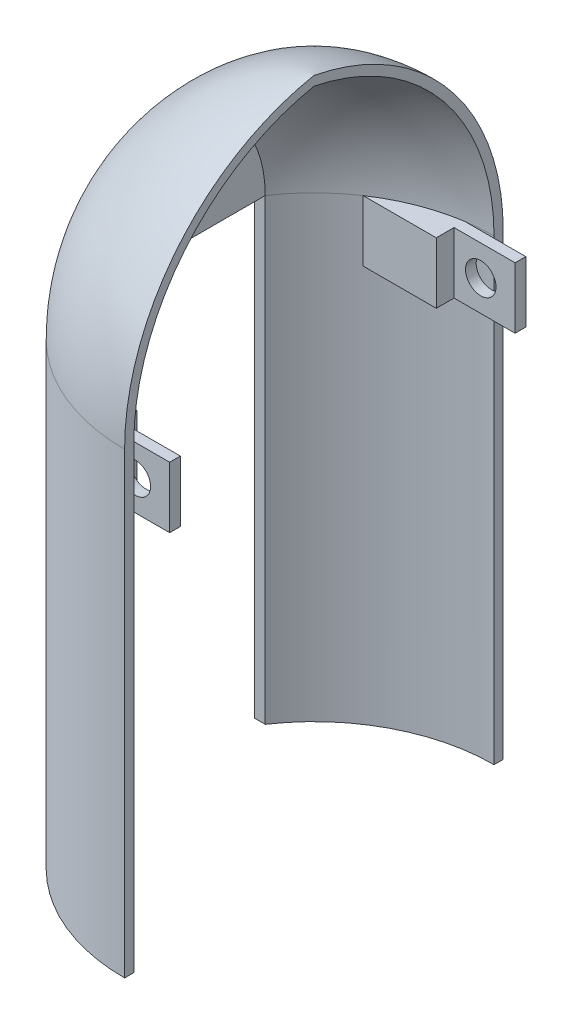
from build123d import *

# Parameters (mm, degrees)
SKETCH2_OUTSIDE_W        = 164.146
SKETCH2_OUTSIDE_H        = 164.146
SKETCH2_OUTSIDE_W_2      = 105
SKETCH2_OUTSIDE_H_2      = 145.767420334
CUT_EXTRUDE2_DEPTH       = 116.381974501
BOSS_EXTRUDE2_REACH      = 112.568
SKETCH3_W                = 3.579145551
SKETCH3_H                = 65.962110336
BOSS_EXTRUDE4_DEPTH      = 150
CUT_EXTRUDE3_DEPTH       = 171.58815789
CUT_EXTRUDE3_DEPTH_BACK  = 171.58815789
SKETCH5_W                = 89.03939756
SKETCH5_H                = 235.639617785
SKETCH6_R                = 1.8
CUT_EXTRUDE4_DEPTH       = 171.587954009
BOSS_EXTRUDE5_REACH      = 170.057
BOSS_EXTRUDE5_END_RADIUS = 59
SKETCH8_W                = 10
SKETCH8_H                = 20
SKETCH9_W                = 3.5
SKETCH9_H                = 20
BOSS_EXTRUDE6_DEPTH      = 20
CUT_EXTRUDE5_REACH       = 201.333
SKETCH10_R               = 5


with BuildPart() as part:
    # Sketch1 → Revolve1 (revolve)
    with BuildSketch(Plane.XY):
        with BuildLine():
            Line((62, 0), (59, 0))
            ThreePointArc((59, 0), (42.363721251, 46.52102369), (0, 71.943189953))
            Line((0, 71.943189953), (0, 75))
            ThreePointArc((0, 75), (44.493217858, 48.65439343), (62, 0))
        make_face()
    revolve(axis=Axis((0, 75, 0), (0, -1, 0)))

    # Sketch2 outside → Cut-Extrude2 (cut, through all)
    with BuildSketch(Plane(origin=(0, 0, 0), x_dir=(-1, 0, 0), z_dir=(0, -1, 0))):
        Rectangle(SKETCH2_OUTSIDE_W, SKETCH2_OUTSIDE_H)
        Rectangle(SKETCH2_OUTSIDE_W_2, SKETCH2_OUTSIDE_H_2, mode=Mode.SUBTRACT)
    extrude(amount=-CUT_EXTRUDE2_DEPTH, mode=Mode.SUBTRACT)

    # Sketch3 → Boss-Extrude2 (add, up to next)
    with BuildSketch(Plane.XZ, mode=Mode.PRIVATE) as boss_extrude2_sk1:
        with Locations((-50.710427225, 0)):
            Rectangle(SKETCH3_W, SKETCH3_H)
    boss_extrude2_tool1 = extrude(boss_extrude2_sk1.sketch, amount=-BOSS_EXTRUDE2_REACH, mode=Mode.PRIVATE) - part.part
    # Sketch3 → Boss-Extrude2 (add, up to next)
    with BuildSketch(Plane.XZ, mode=Mode.PRIVATE) as boss_extrude2_sk2:
        with Locations((50.710427225, 0)):
            Rectangle(SKETCH3_W, SKETCH3_H)
    boss_extrude2_tool2 = extrude(boss_extrude2_sk2.sketch, amount=-BOSS_EXTRUDE2_REACH, mode=Mode.PRIVATE) - part.part
    add(boss_extrude2_tool1.solids().sort_by_distance((-50.710427, 0, 0))[0])
    add(boss_extrude2_tool2.solids().sort_by_distance((50.710427, 0, 0))[0])

    # Sketch4 → Boss-Extrude4 (add)
    with BuildSketch(Plane(origin=(0, 0, 0), x_dir=(-1, 0, 0), z_dir=(0, -1, 0))):
        with BuildLine():
            Line((52.500662853, -32.98), (48.921565797, -32.98))
            ThreePointArc((48.921565797, -32.98), (0, -59), (-48.921565797, -32.98))
            Line((-48.921565797, -32.98), (-52.500662853, -32.98))
            ThreePointArc((-52.500662853, -32.98), (0, -62), (52.500662853, -32.98))
        make_face()
        with BuildLine():
            Line((-48.921565797, 32.98), (-52.500662853, 32.98))
            ThreePointArc((-52.500662853, 32.98), (0, 62), (52.500662853, 32.98))
            Line((52.500662853, 32.98), (48.921565797, 32.98))
            ThreePointArc((48.921565797, 32.98), (0, 59), (-48.921565797, 32.98))
        make_face()
    extrude(amount=BOSS_EXTRUDE4_DEPTH)

    # Sketch5 → Cut-Extrude3 (cut, two sides: drawn at the far end of the back side and taken through both)
    with BuildSketch(Plane.XY.offset(-CUT_EXTRUDE3_DEPTH_BACK)):
        with Locations((44.51969878, -36.450714171)):
            Rectangle(SKETCH5_W, SKETCH5_H)
    extrude(amount=CUT_EXTRUDE3_DEPTH + CUT_EXTRUDE3_DEPTH_BACK, mode=Mode.SUBTRACT)

    # Sketch6 → Cut-Extrude4 (cut, through all)
    with BuildSketch(Plane.ZY.offset(52.5)):
        with Locations((-5, 10)):
            Circle(SKETCH6_R)
        with Locations((5, 10)):
            Circle(SKETCH6_R)
    extrude(amount=-CUT_EXTRUDE4_DEPTH, mode=Mode.SUBTRACT)

    # Boss-Extrude5: up to this cylinder (the profile starts inside it)
    boss_extrude5_end = Plane(origin=(0, -10, 0), z_dir=(0, 1, 0)) * Cylinder(BOSS_EXTRUDE5_END_RADIUS, 459.114, mode=Mode.PRIVATE)
    # Sketch8 → Boss-Extrude5 (add, up to the surface)
    with BuildSketch(Plane(origin=(-8.920854449, 0, 0), x_dir=(0, 0, -1), z_dir=(1, 0, 0)), mode=Mode.PRIVATE) as boss_extrude5_sk1:
        with Locations((54, -10)):
            Rectangle(SKETCH8_W, SKETCH8_H)
    boss_extrude5_tool1 = extrude(boss_extrude5_sk1.sketch, amount=-BOSS_EXTRUDE5_REACH, mode=Mode.PRIVATE) & boss_extrude5_end
    add(boss_extrude5_tool1.solids().sort_by_distance((-8.920854, -10, -54))[0])
    # Sketch8 → Boss-Extrude5 (add, up to the surface)
    with BuildSketch(Plane(origin=(-8.920854449, 0, 0), x_dir=(0, 0, -1), z_dir=(1, 0, 0)), mode=Mode.PRIVATE) as boss_extrude5_sk2:
        with Locations((-54, -10)):
            Rectangle(SKETCH8_W, SKETCH8_H)
    boss_extrude5_tool2 = extrude(boss_extrude5_sk2.sketch, amount=-BOSS_EXTRUDE5_REACH, mode=Mode.PRIVATE) & boss_extrude5_end
    add(boss_extrude5_tool2.solids().sort_by_distance((-8.920854, -10, 54))[0])

    # Sketch9 → Boss-Extrude6 (add)
    with BuildSketch(Plane(origin=(-8.920854449, 0, 0), x_dir=(0, 0, -1), z_dir=(1, 0, 0))):
        with Locations((56.571679982, -10)):
            Rectangle(SKETCH9_W, SKETCH9_H)
        with Locations((-56.571679982, -10)):
            Rectangle(SKETCH9_W, SKETCH9_H)
    extrude(amount=BOSS_EXTRUDE6_DEPTH)

    # Cut-Extrude5: up to this face of the body (flat: up to its plane)
    cut_extrude5_end = Plane(part.part.faces().sort_by_distance((1.079145551, -10, -58.321679982))[0])
    # Sketch10 → Cut-Extrude5 (cut, up to the picked face)
    with BuildSketch(Plane.XY.offset(58.321679982), mode=Mode.PRIVATE) as cut_extrude5_sk1:
        with Locations((-0.170854449, -10)):
            Circle(SKETCH10_R)
    cut_extrude5_tool1 = split(extrude(cut_extrude5_sk1.sketch, amount=-CUT_EXTRUDE5_REACH, mode=Mode.PRIVATE), bisect_by=cut_extrude5_end, keep=Keep.BOTH, mode=Mode.PRIVATE)
    add(cut_extrude5_tool1.solids().sort_by(Axis((-0.170854, -10, 58.32168), (0, 0, -1)))[0], mode=Mode.SUBTRACT)


solid = part.part
